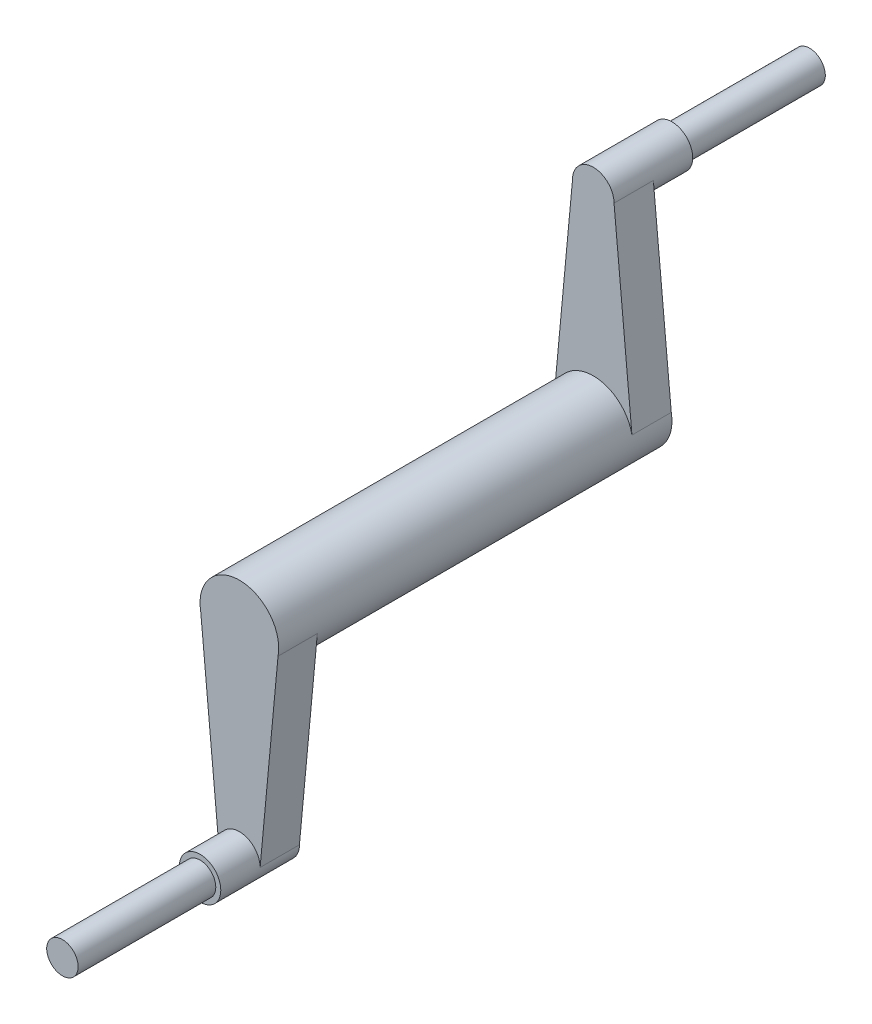
from build123d import *

# Parameters (mm, degrees)
SKETCH_1_R               = 20
EXTRUDE_2_DEPTH          = 100
EXTRUDE_3_DEPTH          = 20
SKETCH_3_R               = 10.544762533
EXTRUDE_4_DEPTH          = 20
SKETCH_4_R               = 8
EXTRUDE_5_DEPTH          = 70
EXTRUDE_START            = 100
SKETCH_5_R               = 20
EXTRUDE_6_DEPTH          = 100
EXTRUDE_8_DEPTH          = 20
SKETCH_7_R               = 10.548482156
EXTRUDE_9_DEPTH          = 20
SKETCH_8_R               = 8
EXTRUDE_10_DEPTH         = 70
CUT_EXTRUDE_1_REACH      = 231.885
CUT_EXTRUDE_1_END_RADIUS = 20


with BuildPart() as part:
    # 草图1 → 凸台-拉伸2 (new body)
    with BuildSketch(Plane.XY):
        Circle(SKETCH_1_R)
    extrude(amount=EXTRUDE_2_DEPTH)

    # 草图2 → 凸台-拉伸3 (add)
    with BuildSketch(Plane.XY.offset(100)):
        Polygon((-20, 0), (-10.544762533, -101.307170503), (10.544762533, -101.307170503), (20, 0), align=None)
    extrude(amount=-EXTRUDE_3_DEPTH)

    # 草图3 → 凸台-拉伸4 (add, symmetric)
    with BuildSketch(Plane.XY.offset(100)):
        with Locations((0, -101.307170503)):
            Circle(SKETCH_3_R)
    extrude(amount=EXTRUDE_4_DEPTH, both=True)

    # 草图4 → 凸台-拉伸5 (add)
    with BuildSketch(Plane.XY.offset(120)):
        with Locations((0, -101.307170503)):
            Circle(SKETCH_4_R)
    extrude(amount=EXTRUDE_5_DEPTH)

    # 草图5 → 凸台-拉伸6 (add)
    with BuildSketch(Plane(origin=(0, 0, 0), x_dir=(-1, 0, 0), z_dir=(0, 0, -1)).offset(EXTRUDE_START)):
        Circle(SKETCH_5_R)
    extrude(amount=-EXTRUDE_6_DEPTH)

    # 草图6 → 凸台-拉伸8 (add)
    with BuildSketch(Plane(origin=(0, 0, -100), x_dir=(-1, 0, 0), z_dir=(0, 0, -1))):
        Polygon((20, 0), (10.548482156, 101.307517591), (-10.548482156, 101.307517591), (-20, 0), align=None)
    extrude(amount=-EXTRUDE_8_DEPTH)

    # 草图7 → 凸台-拉伸9 (add, symmetric)
    with BuildSketch(Plane(origin=(0, 0, -100), x_dir=(-1, 0, 0), z_dir=(0, 0, -1))):
        with Locations((0, 101.307517591)):
            Circle(SKETCH_7_R)
    extrude(amount=EXTRUDE_9_DEPTH, both=True)

    # 草图8 → 凸台-拉伸10 (add)
    with BuildSketch(Plane(origin=(0, 0, -120), x_dir=(-1, 0, 0), z_dir=(0, 0, -1))):
        with Locations((0, 101.307517591)):
            Circle(SKETCH_8_R)
    extrude(amount=EXTRUDE_10_DEPTH)

    # 切除-拉伸1: up to this cylinder (the profile starts inside it)
    cut_extrude_1_end = Plane(origin=(0, 0, 0), z_dir=(0, 0, -1)) * Cylinder(CUT_EXTRUDE_1_END_RADIUS, 504.77, mode=Mode.PRIVATE)
    # 草图9 → 切除-拉伸1 (cut, up to the surface)
    with BuildSketch(Plane(origin=(0, -16, 0), x_dir=(1, 0, 0), z_dir=(0, 1, 0)), mode=Mode.PRIVATE) as cut_extrude_1_sk1:
        with BuildLine():
            Line((6, -8), (6, 8))
            ThreePointArc((6, 8), (0, 14), (-6, 8))
            Line((-6, 8), (-6, -8))
            ThreePointArc((-6, -8), (0, -14), (6, -8))
        make_face()
    cut_extrude_1_tool1 = extrude(cut_extrude_1_sk1.sketch, amount=-CUT_EXTRUDE_1_REACH, mode=Mode.PRIVATE) & cut_extrude_1_end
    add(cut_extrude_1_tool1.solids().sort_by_distance((0, -16, 0))[0], mode=Mode.SUBTRACT)


solid = part.part
